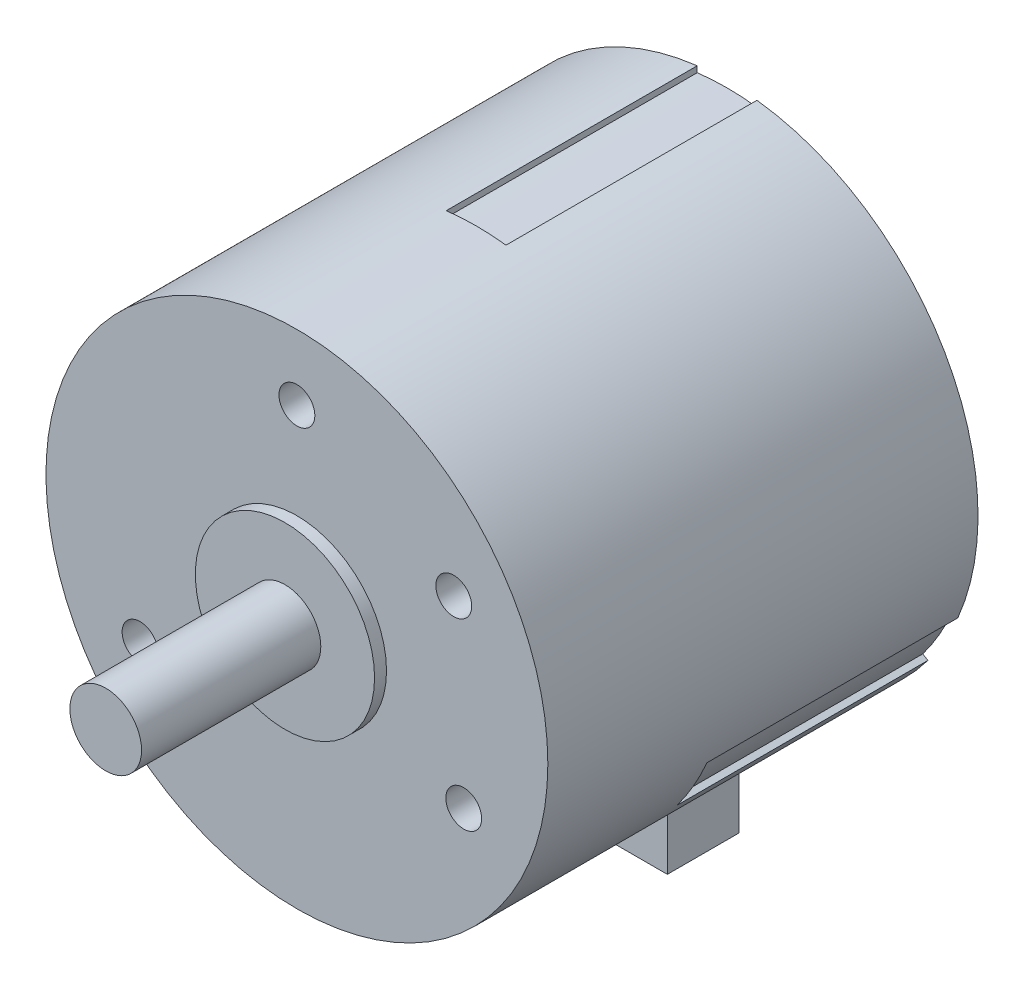
from build123d import *
from build123d.topology import SkipClean

# Parameters (mm, degrees)
SKETCH_1_R          = 21
EXTRUDE_1_DEPTH     = 15
EXTRUDE_START       = 6
EXTRUDE_2_DEPTH     = 6
EXTRUDE_3_DEPTH     = 6
EXTRUDE_START_2     = 9
EXTRUDE_4_DEPTH     = 9
SKETCH_6_R          = 7.5
EXTRUDE_5_DEPTH     = 1
SKETCH_7_R          = 3
EXTRUDE_6_DEPTH     = 15
SKETCH_8_R          = 1.5
CUT_EXTRUDE_1_DEPTH = 3


with BuildPart() as part:
    # 草图1 → 凸台-拉伸1 (new body)
    with BuildSketch(Plane.XY):
        Circle(SKETCH_1_R)
    extrude(amount=EXTRUDE_1_DEPTH)

    # 草图2 → 凸台-拉伸2 (add)
    with SkipClean():  # the faces are left unmerged after this step: merging them gives an invalid solid
        with BuildSketch(Plane(origin=(0, 0, 0), x_dir=(-1, 0, 0), z_dir=(0, 0, -1)).offset(EXTRUDE_START)):
            with BuildLine():
                Line((2.5, 20.850659462), (2.5, 20.346989949))
                ThreePointArc((2.5, 20.346989949), (0, 20.5), (-2.5, 20.346989949))
                Line((-2.5, 20.346989949), (-2.5, 20.850659462))
                ThreePointArc((-2.5, 20.850659462), (-18.186533479, 10.5), (-19.30720078, -8.260266222))
                Line((-19.30720078, -8.260266222), (-18.871010187, -8.008431465))
                ThreePointArc((-18.871010187, -8.008431465), (-17.753520778, -10.25), (-16.371010187, -12.338558484))
                Line((-16.371010187, -12.338558484), (-16.80720078, -12.59039324))
                ThreePointArc((-16.80720078, -12.59039324), (-15.938440593, -13.673555187), (-15, -14.696938457))
                Line((-15, -14.696938457), (-15, -13.973188612))
                ThreePointArc((-15, -13.973188612), (0, -20.5), (15, -13.973188612))
                Line((15, -13.973188612), (15, -14.696938457))
                ThreePointArc((15, -14.696938457), (15.938440593, -13.673555187), (16.80720078, -12.59039324))
                Line((16.80720078, -12.59039324), (16.371010187, -12.338558484))
                ThreePointArc((16.371010187, -12.338558484), (17.753520778, -10.25), (18.871010187, -8.008431465))
                Line((18.871010187, -8.008431465), (19.30720078, -8.260266222))
                ThreePointArc((19.30720078, -8.260266222), (18.186533479, 10.5), (2.5, 20.850659462))
            make_face()
        extrude(amount=-EXTRUDE_2_DEPTH)

    # 草图4 → 凸台-拉伸3 (add)
    with SkipClean():  # the faces are left unmerged after this step: merging them gives an invalid solid
        with BuildSketch(Plane(origin=(0, 0, -6), x_dir=(-1, 0, 0), z_dir=(0, 0, -1)).offset(EXTRUDE_START)):
            with BuildLine():
                Line((10, -17.895530168), (10, -24))
                Line((10, -24), (-10, -24))
                Line((-10, -24), (-10, -17.895530168))
                ThreePointArc((-10, -17.895530168), (-12.652912345, -16.129284212), (-15, -13.973188612))
                Line((-15, -13.973188612), (-15, -14.696938457))
                ThreePointArc((-15, -14.696938457), (-15.938440593, -13.673555187), (-16.80720078, -12.59039324))
                Line((-16.80720078, -12.59039324), (-16.371010187, -12.338558484))
                ThreePointArc((-16.371010187, -12.338558484), (-17.753520778, -10.25), (-18.871010187, -8.008431465))
                Line((-18.871010187, -8.008431465), (-19.30720078, -8.260266222))
                ThreePointArc((-19.30720078, -8.260266222), (-18.186533479, 10.5), (-2.5, 20.850659462))
                Line((-2.5, 20.850659462), (-2.5, 20.346989949))
                ThreePointArc((-2.5, 20.346989949), (0, 20.5), (2.5, 20.346989949))
                Line((2.5, 20.346989949), (2.5, 20.850659462))
                ThreePointArc((2.5, 20.850659462), (18.186533479, 10.5), (19.30720078, -8.260266222))
                Line((19.30720078, -8.260266222), (18.871010187, -8.008431465))
                ThreePointArc((18.871010187, -8.008431465), (17.753520778, -10.25), (16.371010187, -12.338558484))
                Line((16.371010187, -12.338558484), (16.80720078, -12.59039324))
                ThreePointArc((16.80720078, -12.59039324), (15.938440593, -13.673555187), (15, -14.696938457))
                Line((15, -14.696938457), (15, -13.973188612))
                ThreePointArc((15, -13.973188612), (12.652912345, -16.129284212), (10, -17.895530168))
            make_face()
        extrude(amount=-EXTRUDE_3_DEPTH)

    # 草图5 → 凸台-拉伸4 (add)
    with SkipClean():  # the faces are left unmerged after this step: merging them gives an invalid solid
        with BuildSketch(Plane(origin=(0, 0, -12), x_dir=(-1, 0, 0), z_dir=(0, 0, -1)).offset(EXTRUDE_START_2)):
            with BuildLine():
                Line((18.871010187, -8.008431465), (19.30720078, -8.260266222))
                ThreePointArc((19.30720078, -8.260266222), (18.186533479, 10.5), (2.5, 20.850659462))
                Line((2.5, 20.850659462), (2.5, 20.346989949))
                ThreePointArc((2.5, 20.346989949), (0, 20.5), (-2.5, 20.346989949))
                Line((-2.5, 20.346989949), (-2.5, 20.850659462))
                ThreePointArc((-2.5, 20.850659462), (-18.186533479, 10.5), (-19.30720078, -8.260266222))
                Line((-19.30720078, -8.260266222), (-18.871010187, -8.008431465))
                ThreePointArc((-18.871010187, -8.008431465), (-17.753520778, -10.25), (-16.371010187, -12.338558484))
                Line((-16.371010187, -12.338558484), (-16.80720078, -12.59039324))
                ThreePointArc((-16.80720078, -12.59039324), (-15.938440593, -13.673555187), (-15, -14.696938457))
                ThreePointArc((-15, -14.696938457), (0, -21), (15, -14.696938457))
                ThreePointArc((15, -14.696938457), (15.938440593, -13.673555187), (16.80720078, -12.59039324))
                Line((16.80720078, -12.59039324), (16.371010187, -12.338558484))
                ThreePointArc((16.371010187, -12.338558484), (17.753520778, -10.25), (18.871010187, -8.008431465))
            make_face()
        extrude(amount=-EXTRUDE_4_DEPTH)

    # 草图6 → 凸台-拉伸5 (add)
    with SkipClean():  # the faces are left unmerged after this step: merging them gives an invalid solid
        with BuildSketch(Plane.XY.offset(15)):
            Circle(SKETCH_6_R)
        extrude(amount=EXTRUDE_5_DEPTH)

    # 草图7 → 凸台-拉伸6 (add)
    with SkipClean():  # the faces are left unmerged after this step: merging them gives an invalid solid
        with BuildSketch(Plane.XY.offset(16)):
            Circle(SKETCH_7_R)
        extrude(amount=EXTRUDE_6_DEPTH)

    # 草图8 → 切除-拉伸1 (cut)
    with SkipClean():  # the faces are left unmerged after this step: merging them gives an invalid solid
        with BuildSketch(Plane.XY.offset(15)):
            with Locations((0, 15.5)):
                Circle(SKETCH_8_R)
            with Locations((13.12709029, 8.241935484)):
                Circle(SKETCH_8_R)
            with Locations((13.960339517, -6.734903159)):
                Circle(SKETCH_8_R)
            with Locations((-13.12709029, -8.241935484)):
                Circle(SKETCH_8_R)
        extrude(amount=-CUT_EXTRUDE_1_DEPTH, mode=Mode.SUBTRACT)


solid = part.part
